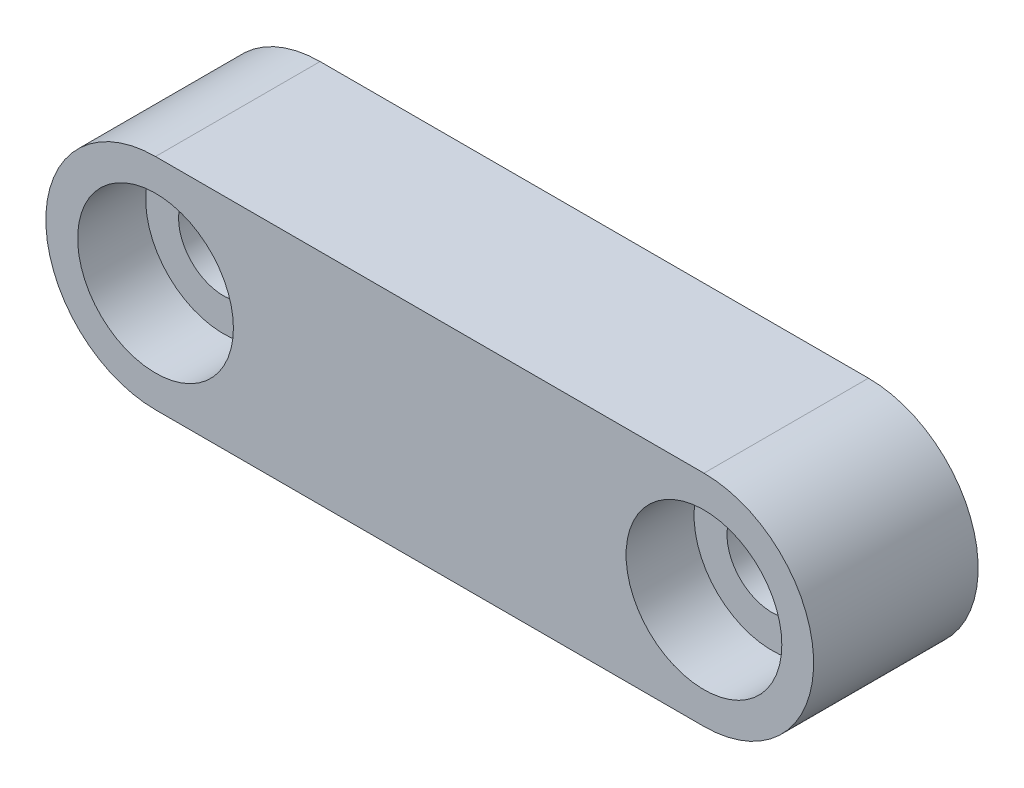
from build123d import *

# Parameters (mm, degrees)
SKETCH_1_R          = 2.05
EXTRUDE_1_DEPTH     = 7.5
SKETCH_2_R          = 3.55
CUT_EXTRUDE_1_DEPTH = 3.1


with BuildPart() as part:
    # 草圖1 → 填料-伸長1 (new body)
    with BuildSketch(Plane.XY):
        with BuildLine():
            Line((-12.5, 5), (12.5, 5))
            ThreePointArc((12.5, 5), (17.5, 0), (12.5, -5))
            Line((12.5, -5), (-12.5, -5))
            ThreePointArc((-12.5, -5), (-17.5, 0), (-12.5, 5))
        make_face()
        with Locations((-12.5, 0)):
            Circle(SKETCH_1_R, mode=Mode.SUBTRACT)
        with Locations((12.5, 0)):
            Circle(SKETCH_1_R, mode=Mode.SUBTRACT)
    extrude(amount=EXTRUDE_1_DEPTH)

    # 草圖2 → 除料-伸長1 (cut)
    with BuildSketch(Plane.XY.offset(7.5)):
        with Locations((12.5, 0)):
            Circle(SKETCH_2_R)
        with Locations((-12.5, 0)):
            Circle(SKETCH_2_R)
    extrude(amount=-CUT_EXTRUDE_1_DEPTH, mode=Mode.SUBTRACT)


solid = part.part
